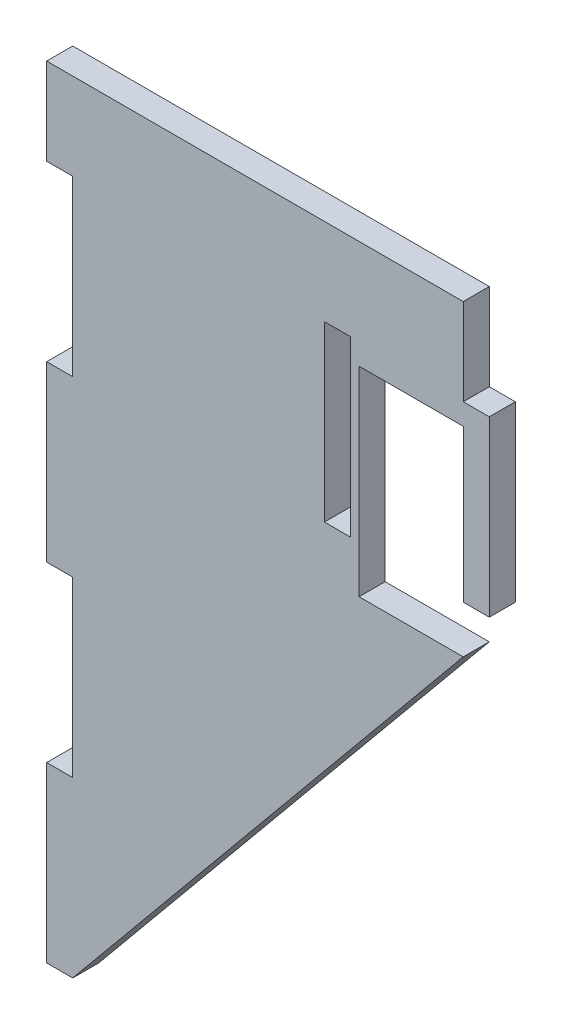
from build123d import *

# Parameters (mm, degrees)
SKETCH1_W           = 3
SKETCH1_H           = 20
BOSS_EXTRUDE1_DEPTH = 3


with BuildPart() as part:
    # Sketch1 → Boss-Extrude1 (new body)
    with BuildSketch(Plane.XY):
        Polygon((-3, 60), (-3, 40), (0, 40), (0, 20), (-3, 20), (-3, 0), (0, 0), (45, 54.545454545), (33, 54.545454545), (33, 77.545454545), (45, 77.545454545), (45, 60), (48, 60), (48, 80), (45, 80), (45, 90), (15, 90), (-3, 90), (-3, 80), (0, 80), (0, 60), align=None)
        with Locations((30.5, 70)):
            Rectangle(SKETCH1_W, SKETCH1_H, mode=Mode.SUBTRACT)
    extrude(amount=BOSS_EXTRUDE1_DEPTH)


solid = part.part
